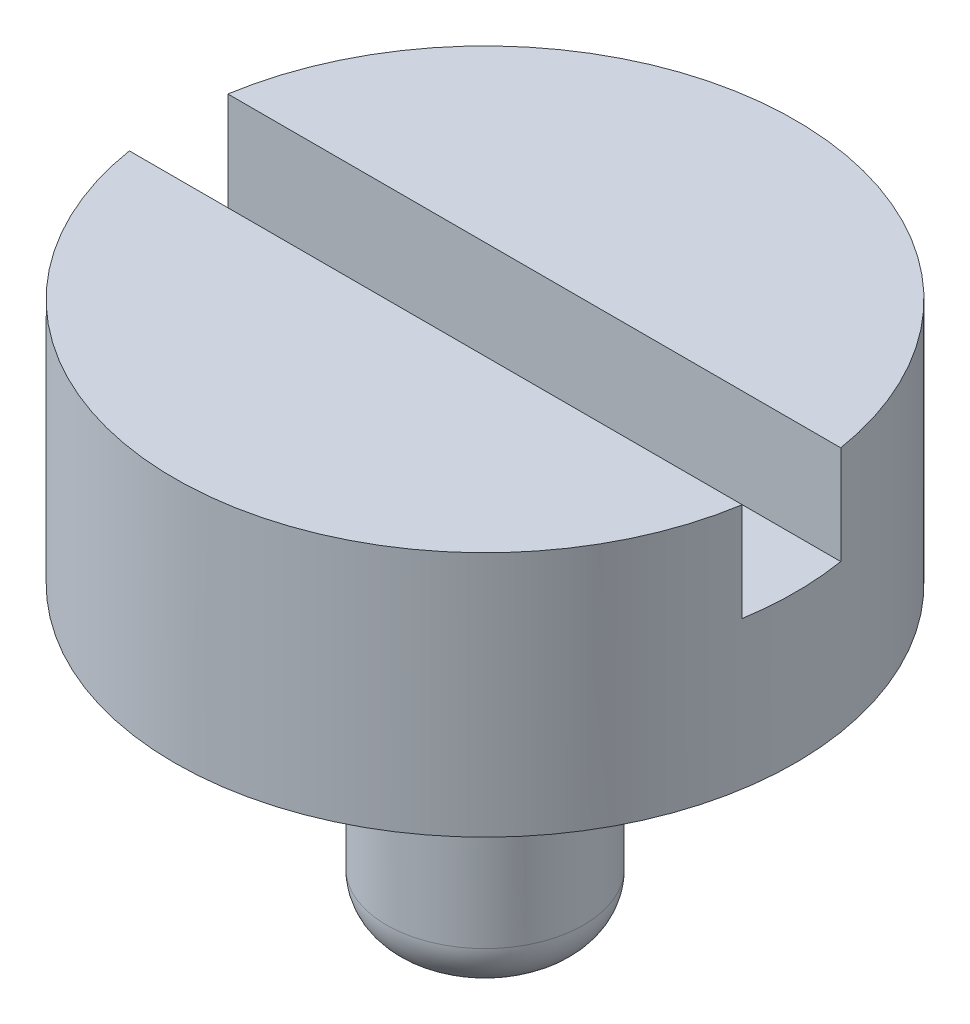
from build123d import *

# Parameters (mm, degrees)
SKETCH1_R           = 2.54
BOSS_EXTRUDE1_DEPTH = 7.62
SKETCH2_R           = 8.001
BOSS_EXTRUDE2_DEPTH = 6.35
FILLET1_R           = 1.27
SKETCH3_W           = 2.54
SKETCH3_H           = 2.54
CUT_EXTRUDE1_DEPTH  = 63.5


with BuildPart() as part:
    # Sketch1 → Boss-Extrude1 (new body)
    with BuildSketch(Plane(origin=(0, 0, 0), x_dir=(1, 0, 0), z_dir=(0, 1, 0))):
        with Locations(Location((0, 0, 0), (0, 0, 90))):
            Circle(SKETCH1_R)
    extrude(amount=BOSS_EXTRUDE1_DEPTH)

    # Sketch2 → Boss-Extrude2 (add)
    with BuildSketch(Plane(origin=(0, 7.62, 0), x_dir=(1, 0, 0), z_dir=(0, 1, 0))):
        with Locations(Location((0, 0, 0), (0, 0, 270))):
            Circle(SKETCH2_R)
    extrude(amount=BOSS_EXTRUDE2_DEPTH)

    # Fillet1
    fillet1_edges = [part.edges().sort_by_distance(p)[0] for p in [
        (0, 0, 2.54),
    ]]
    fillet(fillet1_edges, radius=FILLET1_R)

    # Sketch3 → Cut-Extrude1 (cut, symmetric)
    with BuildSketch(Plane(origin=(0, 0, 0), x_dir=(0, 0, -1), z_dir=(1, 0, 0))):
        with Locations((0, 12.7)):
            Rectangle(SKETCH3_W, SKETCH3_H)
    extrude(amount=CUT_EXTRUDE1_DEPTH, both=True, mode=Mode.SUBTRACT)


solid = part.part
